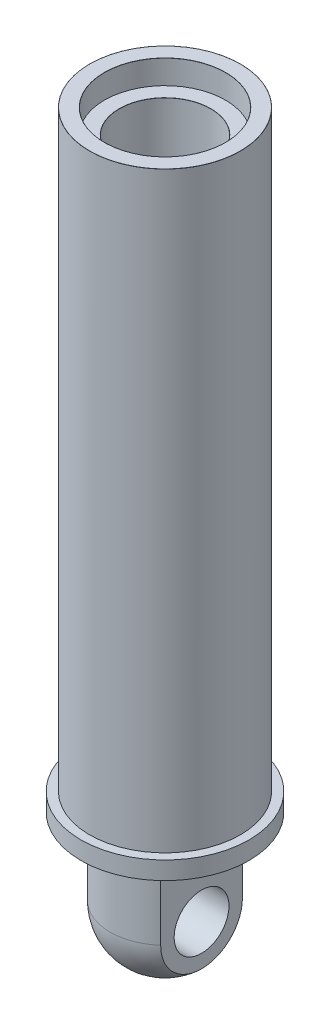
from build123d import *

# Parameters (mm, degrees)
CUT_EXTRUDE1_DEPTH      = 304.831137641
CUT_EXTRUDE1_DEPTH_BACK = 304.831137641
SKETCH2_R               = 11.085
CUT_EXTRUDE2_DEPTH      = 304.831137641
CUT_EXTRUDE2_DEPTH_BACK = 304.831137641
FILLET1_R               = 0.146825397
SKETCH8_R               = 24.5
CUT_EXTRUDE3_DEPTH      = 9.690476191
FILLET4_R               = 0.044047619


with BuildPart() as part:
    # Sketch1 → Revolve1 (revolve)
    with BuildSketch(Plane.XY):
        with BuildLine():
            Line((34.01, 60.44), (30.5, 60.44))
            Line((30.5, 60.44), (30.5, 300))
            Line((30.5, 300), (18.5, 300))
            Line((18.5, 300), (18.5, 60.44))
            Line((18.5, 60.44), (0, 60.44))
            Line((0, 60.44), (0, 0))
            ThreePointArc((0, 0), (15.676557339, 6.493442661), (22.17, 22.17))
            Line((22.17, 22.17), (22.17, 53.2))
            Line((22.17, 53.2), (34.01, 53.2))
            Line((34.01, 53.2), (34.01, 60.44))
        make_face()
    revolve(axis=Axis((0, 0, 0), (0, 1, 0)))

    # Sketch2 → Cut-Extrude1 (cut, two sides: drawn at the far end of the back side and taken through both)
    with BuildSketch(Plane(origin=(0, 0, 0), x_dir=(0, 0, -1), z_dir=(1, 0, 0)).offset(-CUT_EXTRUDE1_DEPTH_BACK)):
        with Locations((0, 22.17)):
            Circle(SKETCH2_R)
    extrude(amount=CUT_EXTRUDE1_DEPTH + CUT_EXTRUDE1_DEPTH_BACK, mode=Mode.SUBTRACT)

    # Sketch3 → Cut-Extrude2 (cut, two sides: drawn at the far end of the back side and taken through both)
    with BuildSketch(Plane.XY.offset(-CUT_EXTRUDE2_DEPTH_BACK)):
        Polygon((-53.33, 49.26), (-53.33, 0), (-14.78, 0), (-14.78, 28.148148148), (-14.78, 49.26), (-35.888888889, 49.26), align=None)
        Polygon((35.888888889, 49.26), (53.33, 49.26), (53.33, 0), (14.78, 0), (14.78, 28.148148148), (14.78, 49.26), align=None)
    extrude(amount=CUT_EXTRUDE2_DEPTH + CUT_EXTRUDE2_DEPTH_BACK, mode=Mode.SUBTRACT)

    # Fillet1
    fillet1_edges = [part.edges().sort_by_distance(p)[0] for p in [
        (-22.17, 53.2, 0),
        (14.78, 49.26, 0),
        (-14.78, 49.26, 0),
    ]]
    fillet(fillet1_edges, radius=FILLET1_R)

    # Sketch8 → Cut-Extrude3 (cut)
    with BuildSketch(Plane(origin=(0, 300, 0), x_dir=(1, 0, 0), z_dir=(0, 1, 0))):
        with Locations(Location((0, 0, 0), (0, 0, 180))):
            Circle(SKETCH8_R)
    extrude(amount=-CUT_EXTRUDE3_DEPTH, mode=Mode.SUBTRACT)

    # Fillet4
    fillet4_edges = [part.edges().sort_by_distance(p)[0] for p in [
        (-18.5, 290.309523809, 0),
        (24.5, 300, 0),
        (-30.5, 300, 0),
    ]]
    fillet(fillet4_edges, radius=FILLET4_R)


solid = part.part
